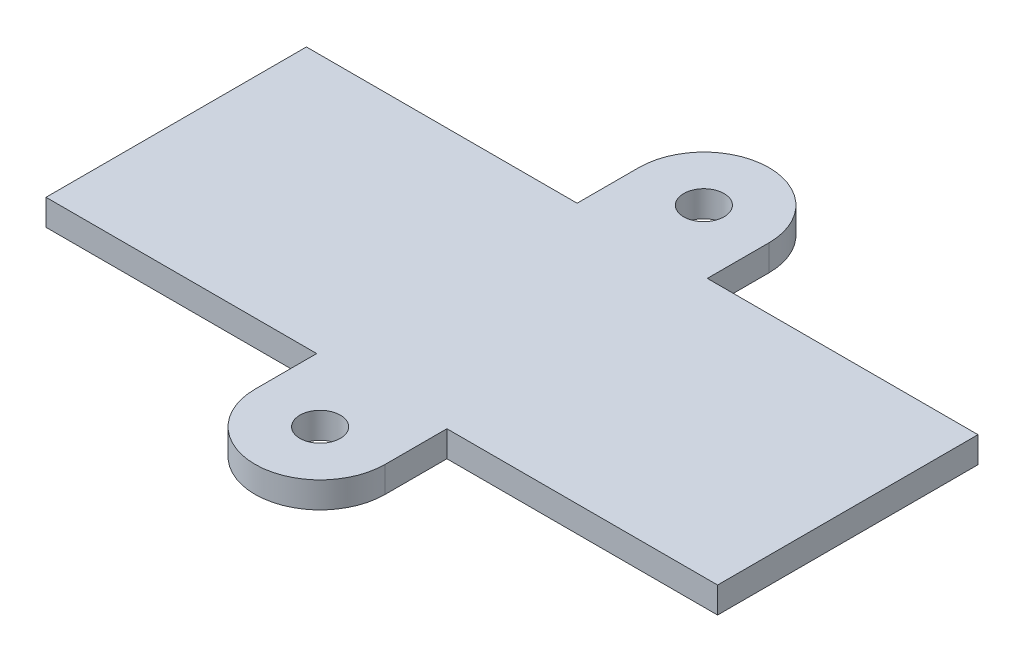
from build123d import *

# Parameters (mm, degrees)
SKETCH1_W           = 49
SKETCH1_H           = 19
BOSS_EXTRUDE1_DEPTH = 1.9
SKETCH2_R           = 1.4732
BOSS_EXTRUDE2_DEPTH = 1.9


with BuildPart() as part:
    # Sketch1 → Boss-Extrude1 (new body)
    with BuildSketch(Plane(origin=(0, 0, 0), x_dir=(1, 0, 0), z_dir=(0, 1, 0))):
        Rectangle(SKETCH1_W, SKETCH1_H)
    extrude(amount=BOSS_EXTRUDE1_DEPTH)

    # Sketch2 → Boss-Extrude2 (add)
    # profile 1 of 2: a face of its own
    with BuildSketch(Plane(origin=(0, 0, 0), x_dir=(1, 0, 0), z_dir=(0, 1, 0))):
        with BuildLine():
            Line((-4.75, 14), (-4.75, 9.5))
            Line((-4.75, 9.5), (4.75, 9.5))
            Line((4.75, 9.5), (4.75, 14))
            ThreePointArc((4.75, 14), (0, 18.75), (-4.75, 14))
        make_face()
        with Locations(Location((0, 14, 0), (0, 0, 90))):
            Circle(SKETCH2_R, mode=Mode.SUBTRACT)
    # profile 2 of 2: a face of its own
    with BuildSketch(Plane(origin=(0, 0, 0), x_dir=(1, 0, 0), z_dir=(0, 1, 0))):
        with BuildLine():
            Line((4.75, -14), (4.75, -9.5))
            Line((4.75, -9.5), (-4.75, -9.5))
            Line((-4.75, -9.5), (-4.75, -14))
            ThreePointArc((-4.75, -14), (0, -18.75), (4.75, -14))
        make_face()
        with Locations(Location((0, -14, 0), (0, 0, 90))):
            Circle(SKETCH2_R, mode=Mode.SUBTRACT)
    extrude(amount=BOSS_EXTRUDE2_DEPTH)


solid = part.part
